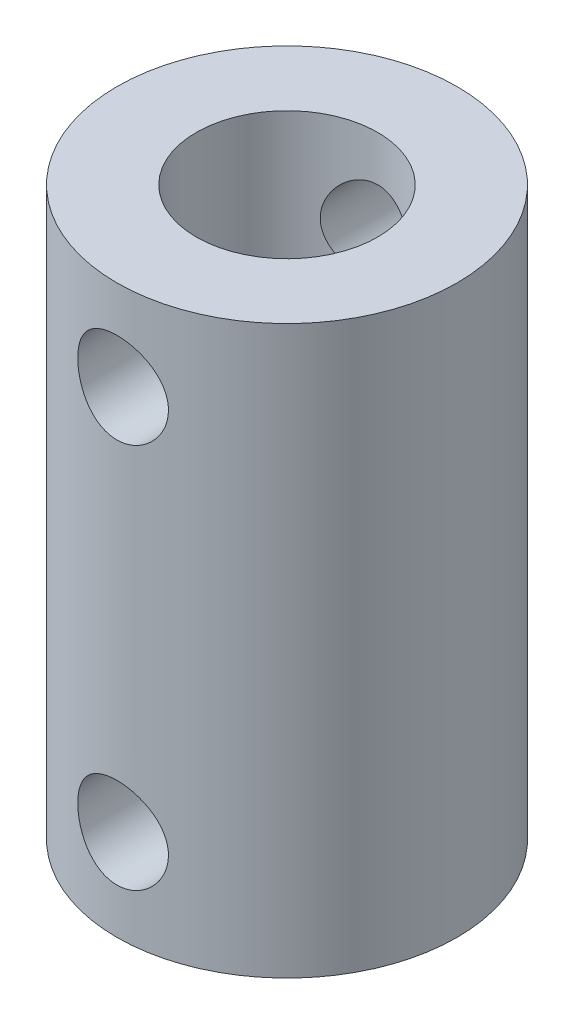
from build123d import *

# Parameters (mm, degrees)
SKETCH1_R               = 7.5
SKETCH1_R_2             = 4
BOSS_EXTRUDE1_DEPTH     = 14
BOSS_EXTRUDE2_START     = 11
SKETCH2_R               = 7.5
SKETCH2_R_2             = 2.5
BOSS_EXTRUDE2_DEPTH     = 11
CUT_EXTRUDE1_DEPTH      = 18.56416807
CUT_EXTRUDE1_DEPTH_BACK = 18.56416807
SKETCH3_R               = 2


with BuildPart() as part:
    # Sketch1 → Boss-Extrude1 (new body)
    with BuildSketch(Plane(origin=(0, 0, 0), x_dir=(1, 0, 0), z_dir=(0, 1, 0))):
        with Locations(Location((0, 0, 0), (0, 0, 270))):
            Circle(SKETCH1_R)
        with Locations(Location((0, 0, 0), (0, 0, 270))):
            Circle(SKETCH1_R_2, mode=Mode.SUBTRACT)
    extrude(amount=BOSS_EXTRUDE1_DEPTH)

    # Sketch2 → Boss-Extrude2 (add)
    with BuildSketch(Plane.XZ.offset(BOSS_EXTRUDE2_START)):
        with Locations(Location((0, 0, 0), (0, 0, 270))):
            Circle(SKETCH2_R)
        with Locations(Location((0, 0, 0), (0, 0, 270))):
            Circle(SKETCH2_R_2, mode=Mode.SUBTRACT)
    extrude(amount=-BOSS_EXTRUDE2_DEPTH)

    # Sketch3 → Cut-Extrude1 (cut, two sides: drawn at the far end of the back side and taken through both)
    with BuildSketch(Plane.XY.offset(-CUT_EXTRUDE1_DEPTH_BACK)):
        with Locations((0, 10)):
            Circle(SKETCH3_R)
        with Locations((0, -7)):
            Circle(SKETCH3_R)
    extrude(amount=CUT_EXTRUDE1_DEPTH + CUT_EXTRUDE1_DEPTH_BACK, mode=Mode.SUBTRACT)


solid = part.part
